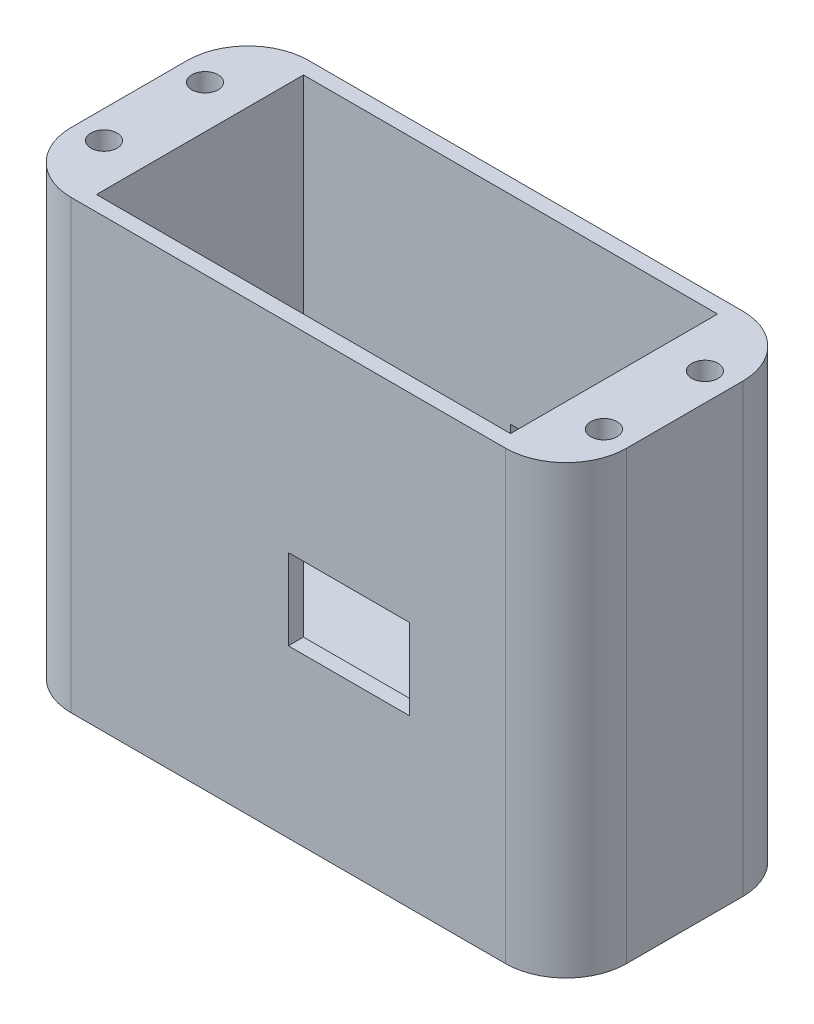
from build123d import *

# Parameters (mm, degrees)
SKETCH1_W               = 55
SKETCH1_H               = 22
BOSS_EXTRUDE1_DEPTH     = 2
BOSS_EXTRUDE2_DEPTH     = 32.2
SKETCH5_R               = 1.3
CUT_EXTRUDE2_DEPTH      = 8
SKETCH1_2_W             = 55
SKETCH1_2_H             = 22
BOSS_EXTRUDE3_DEPTH     = 10
SKETCH11_R              = 1.5
CUT_EXTRUDE8_DEPTH      = 10
CUT_EXTRUDE9_DEPTH      = 5
CUT_EXTRUDE9_DEPTH_BACK = 46.242568451
SKETCH8_R               = 3.2
SKETCH8_4_R             = 6.6
CUT_EXTRUDE10_DEPTH     = 10
SKETCH12_W              = 55
SKETCH12_H              = 44.2
BOSS_EXTRUDE4_DEPTH     = 1.5
FILLET1_R               = 6
CUT_EXTRUDE7_DEPTH      = 50.090630471
CUT_EXTRUDE7_DEPTH_BACK = 50.090630471
SKETCH10_W              = 12
SKETCH10_H              = 8


with BuildPart() as part:
    # Sketch1 → Boss-Extrude1 (new body)
    with BuildSketch(Plane(origin=(0, 0, 0), x_dir=(1, 0, 0), z_dir=(0, 1, 0))):
        Rectangle(SKETCH1_W, SKETCH1_H)
    extrude(amount=BOSS_EXTRUDE1_DEPTH)

    # Sketch2 → Boss-Extrude2 (add)
    with BuildSketch(Plane(origin=(0, 2, 0), x_dir=(1, 0, 0), z_dir=(0, 1, 0))):
        Polygon((-27.5, -11), (-27.5, 11), (27.5, 11), (27.5, -11), (20.5, -11), (20.5, 9.5), (-20.5, 9.5), (-20.5, -11), align=None)
    extrude(amount=BOSS_EXTRUDE2_DEPTH)

    # Sketch5 → Cut-Extrude2 (cut)
    with BuildSketch(Plane(origin=(0, 34.2, 0), x_dir=(1, 0, 0), z_dir=(0, 1, 0))):
        with Locations((-24.75, -6)):
            Circle(SKETCH5_R)
        with Locations((-24.75, 4)):
            Circle(SKETCH5_R)
        with Locations((24.75, 4)):
            Circle(SKETCH5_R)
        with Locations((24.75, -6)):
            Circle(SKETCH5_R)
    extrude(amount=-CUT_EXTRUDE2_DEPTH, mode=Mode.SUBTRACT)

    # Sketch1<2> → Boss-Extrude3 (add)
    with BuildSketch(Plane(origin=(0, 0, 0), x_dir=(1, 0, 0), z_dir=(0, 1, 0))):
        Rectangle(SKETCH1_2_W, SKETCH1_2_H)
    extrude(amount=-BOSS_EXTRUDE3_DEPTH)

    # Sketch11 → Cut-Extrude8 (cut)
    with BuildSketch(Plane.XZ.offset(10)):
        with Locations((14.828145062, -4.942715021)):
            Circle(SKETCH11_R)
        with Locations((14.828145062, 4.942715021)):
            Circle(SKETCH11_R)
        with Locations((4.942715021, -4.942715021)):
            Circle(SKETCH11_R)
        with Locations((4.942715021, 4.942715021)):
            Circle(SKETCH11_R)
        with Locations((-4.942715021, -4.942715021)):
            Circle(SKETCH11_R)
        with Locations((-4.942715021, 4.942715021)):
            Circle(SKETCH11_R)
        with Locations((-14.828145062, -4.942715021)):
            Circle(SKETCH11_R)
        with Locations((-14.828145062, 4.942715021)):
            Circle(SKETCH11_R)
    extrude(amount=-CUT_EXTRUDE8_DEPTH, mode=Mode.SUBTRACT)

    # Sketch8 → Cut-Extrude9 (cut, two sides: drawn at the far end of the back side and taken through both)
    with BuildSketch(Plane.XZ.offset(-CUT_EXTRUDE9_DEPTH_BACK)):
        with Locations((11, 0)):
            Circle(SKETCH8_R)
    extrude(amount=CUT_EXTRUDE9_DEPTH + CUT_EXTRUDE9_DEPTH_BACK, mode=Mode.SUBTRACT)

    # Sketch8<4> → Cut-Extrude10 (cut)
    with BuildSketch(Plane.XZ):
        with Locations((11, 0)):
            Circle(SKETCH8_4_R)
    extrude(amount=-CUT_EXTRUDE10_DEPTH, mode=Mode.SUBTRACT)

    # Sketch12 → Boss-Extrude4 (add)
    with BuildSketch(Plane.XY.offset(11)):
        with Locations((0, 12.1)):
            Rectangle(SKETCH12_W, SKETCH12_H)
    extrude(amount=BOSS_EXTRUDE4_DEPTH)

    # Fillet1
    fillet1_edges = [part.edges().sort_by_distance(p)[0] for p in [
        (-27.5, 12.1, 12.5),
        (-27.5, 12.1, -11),
        (27.5, 12.1, 12.5),
        (27.5, 12.1, -11),
    ]]
    fillet(fillet1_edges, radius=FILLET1_R)

    # Sketch10 → Cut-Extrude7 (cut, two sides: drawn at the far end of the back side and taken through both)
    with BuildSketch(Plane.XY.offset(-9.5).offset(-CUT_EXTRUDE7_DEPTH_BACK)):
        with Locations((6, 10.5)):
            Rectangle(SKETCH10_W, SKETCH10_H)
    extrude(amount=CUT_EXTRUDE7_DEPTH + CUT_EXTRUDE7_DEPTH_BACK, mode=Mode.SUBTRACT)


solid = part.part
